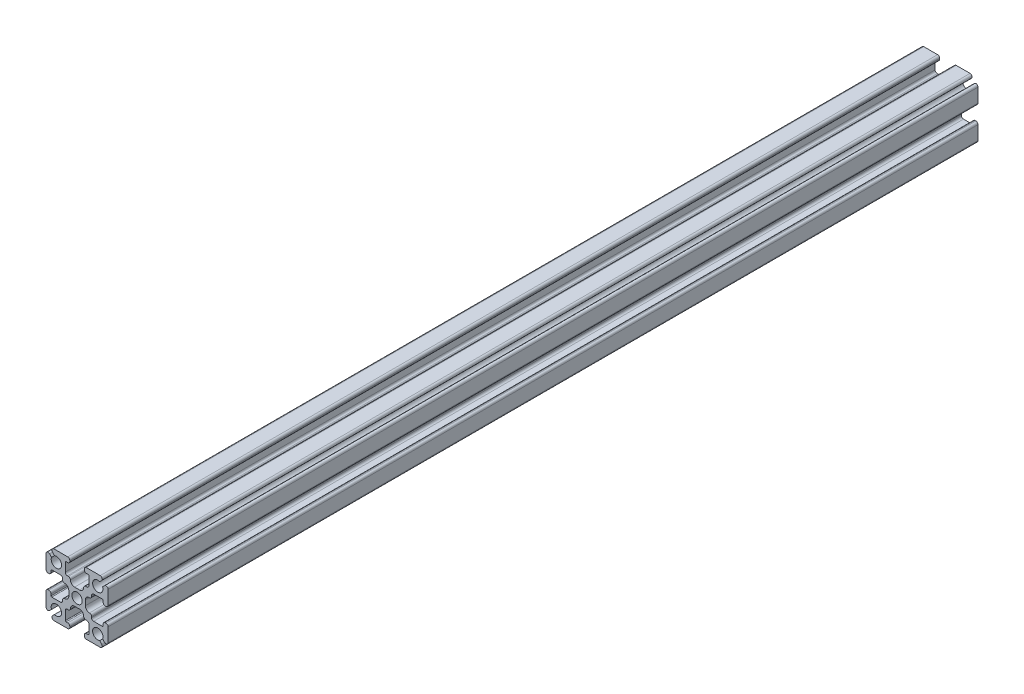
from build123d import *

# Parameters (mm, degrees)
SKETCH1_R           = 1.25
BOSS_EXTRUDE1_DEPTH = 210


with BuildPart() as part:
    # Sketch1 → Boss-Extrude1 (new body)
    with BuildSketch(Plane.XY):
        with BuildLine():
            Line((6.646446609, 5.939339828), (6.163645978, 5.456539197))
            ThreePointArc((6.163645978, 5.456539197), (4.116116524, 4.116116524), (5.456539197, 6.163645978))
            Line((5.456539197, 6.163645978), (5.939339828, 6.646446609))
            ThreePointArc((5.939339828, 6.646446609), (6.047726204, 7.191341716), (5.585786438, 7.5))
            Line((5.585786438, 7.5), (2.25, 7.5))
            ThreePointArc((2.25, 7.5), (1.896446609, 7.353553391), (1.75, 7))
            Line((1.75, 7), (1.75, 6.8))
            ThreePointArc((1.75, 6.8), (1.896446609, 6.446446609), (2.25, 6.3))
            Line((2.25, 6.3), (2.65, 6.3))
            ThreePointArc((2.65, 6.3), (2.791421356, 6.241421356), (2.85, 6.1))
            Line((2.85, 6.1), (2.85, 4))
            ThreePointArc((2.85, 4), (2.703553391, 3.646446609), (2.35, 3.5))
            Line((2.35, 3.5), (2.1, 3.5))
            ThreePointArc((2.1, 3.5), (1.746446609, 3.353553391), (1.6, 3))
            ThreePointArc((1.6, 3), (1.307106781, 2.292893219), (0.6, 2))
            Line((0.6, 2), (-0.6, 2))
            ThreePointArc((-0.6, 2), (-1.307106781, 2.292893219), (-1.6, 3))
            ThreePointArc((-1.6, 3), (-1.746446609, 3.353553391), (-2.1, 3.5))
            Line((-2.1, 3.5), (-2.35, 3.5))
            ThreePointArc((-2.35, 3.5), (-2.703553391, 3.646446609), (-2.85, 4))
            Line((-2.85, 4), (-2.85, 6.1))
            ThreePointArc((-2.85, 6.1), (-2.791421356, 6.241421356), (-2.65, 6.3))
            Line((-2.65, 6.3), (-2.25, 6.3))
            ThreePointArc((-2.25, 6.3), (-1.896446609, 6.446446609), (-1.75, 6.8))
            Line((-1.75, 6.8), (-1.75, 7))
            ThreePointArc((-1.75, 7), (-1.896446609, 7.353553391), (-2.25, 7.5))
            Line((-2.25, 7.5), (-5.585786438, 7.5))
            ThreePointArc((-5.585786438, 7.5), (-6.047726204, 7.191341716), (-5.939339828, 6.646446609))
            Line((-5.939339828, 6.646446609), (-5.456539197, 6.163645978))
            ThreePointArc((-5.456539197, 6.163645978), (-4.116116524, 4.116116524), (-6.163645978, 5.456539197))
            Line((-6.163645978, 5.456539197), (-6.646446609, 5.939339828))
            ThreePointArc((-6.646446609, 5.939339828), (-7.191341716, 6.047726204), (-7.5, 5.585786438))
            Line((-7.5, 5.585786438), (-7.5, 2.25))
            ThreePointArc((-7.5, 2.25), (-7.353553391, 1.896446609), (-7, 1.75))
            Line((-7, 1.75), (-6.8, 1.75))
            ThreePointArc((-6.8, 1.75), (-6.446446609, 1.896446609), (-6.3, 2.25))
            Line((-6.3, 2.25), (-6.3, 2.65))
            ThreePointArc((-6.3, 2.65), (-6.241421356, 2.791421356), (-6.1, 2.85))
            Line((-6.1, 2.85), (-4, 2.85))
            ThreePointArc((-4, 2.85), (-3.646446609, 2.703553391), (-3.5, 2.35))
            Line((-3.5, 2.35), (-3.5, 2.1))
            ThreePointArc((-3.5, 2.1), (-3.353553391, 1.746446609), (-3, 1.6))
            ThreePointArc((-3, 1.6), (-2.292893219, 1.307106781), (-2, 0.6))
            Line((-2, 0.6), (-2, -0.6))
            ThreePointArc((-2, -0.6), (-2.292893219, -1.307106781), (-3, -1.6))
            ThreePointArc((-3, -1.6), (-3.353553391, -1.746446609), (-3.5, -2.1))
            Line((-3.5, -2.1), (-3.5, -2.35))
            ThreePointArc((-3.5, -2.35), (-3.646446609, -2.703553391), (-4, -2.85))
            Line((-4, -2.85), (-6.1, -2.85))
            ThreePointArc((-6.1, -2.85), (-6.241421356, -2.791421356), (-6.3, -2.65))
            Line((-6.3, -2.65), (-6.3, -2.25))
            ThreePointArc((-6.3, -2.25), (-6.446446609, -1.896446609), (-6.8, -1.75))
            Line((-6.8, -1.75), (-7, -1.75))
            ThreePointArc((-7, -1.75), (-7.353553391, -1.896446609), (-7.5, -2.25))
            Line((-7.5, -2.25), (-7.5, -5.585786438))
            ThreePointArc((-7.5, -5.585786438), (-7.191341716, -6.047726204), (-6.646446609, -5.939339828))
            Line((-6.646446609, -5.939339828), (-6.163645978, -5.456539197))
            ThreePointArc((-6.163645978, -5.456539197), (-4.116116524, -4.116116524), (-5.456539197, -6.163645978))
            Line((-5.456539197, -6.163645978), (-5.939339828, -6.646446609))
            ThreePointArc((-5.939339828, -6.646446609), (-6.047726204, -7.191341716), (-5.585786438, -7.5))
            Line((-5.585786438, -7.5), (-2.25, -7.5))
            ThreePointArc((-2.25, -7.5), (-1.896446609, -7.353553391), (-1.75, -7))
            Line((-1.75, -7), (-1.75, -6.8))
            ThreePointArc((-1.75, -6.8), (-1.896446609, -6.446446609), (-2.25, -6.3))
            Line((-2.25, -6.3), (-2.65, -6.3))
            ThreePointArc((-2.65, -6.3), (-2.791421356, -6.241421356), (-2.85, -6.1))
            Line((-2.85, -6.1), (-2.85, -4))
            ThreePointArc((-2.85, -4), (-2.703553391, -3.646446609), (-2.35, -3.5))
            Line((-2.35, -3.5), (-2.1, -3.5))
            ThreePointArc((-2.1, -3.5), (-1.746446609, -3.353553391), (-1.6, -3))
            ThreePointArc((-1.6, -3), (-1.307106781, -2.292893219), (-0.6, -2))
            Line((-0.6, -2), (0.6, -2))
            ThreePointArc((0.6, -2), (1.307106781, -2.292893219), (1.6, -3))
            ThreePointArc((1.6, -3), (1.746446609, -3.353553391), (2.1, -3.5))
            Line((2.1, -3.5), (2.35, -3.5))
            ThreePointArc((2.35, -3.5), (2.703553391, -3.646446609), (2.85, -4))
            Line((2.85, -4), (2.85, -6.1))
            ThreePointArc((2.85, -6.1), (2.791421356, -6.241421356), (2.65, -6.3))
            Line((2.65, -6.3), (2.25, -6.3))
            ThreePointArc((2.25, -6.3), (1.896446609, -6.446446609), (1.75, -6.8))
            Line((1.75, -6.8), (1.75, -7))
            ThreePointArc((1.75, -7), (1.896446609, -7.353553391), (2.25, -7.5))
            Line((2.25, -7.5), (5.585786438, -7.5))
            ThreePointArc((5.585786438, -7.5), (6.047726204, -7.191341716), (5.939339828, -6.646446609))
            Line((5.939339828, -6.646446609), (5.456539197, -6.163645978))
            ThreePointArc((5.456539197, -6.163645978), (4.116116524, -4.116116524), (6.163645978, -5.456539197))
            Line((6.163645978, -5.456539197), (6.646446609, -5.939339828))
            ThreePointArc((6.646446609, -5.939339828), (7.191341716, -6.047726204), (7.5, -5.585786438))
            Line((7.5, -5.585786438), (7.5, -2.25))
            ThreePointArc((7.5, -2.25), (7.353553391, -1.896446609), (7, -1.75))
            Line((7, -1.75), (6.8, -1.75))
            ThreePointArc((6.8, -1.75), (6.446446609, -1.896446609), (6.3, -2.25))
            Line((6.3, -2.25), (6.3, -2.65))
            ThreePointArc((6.3, -2.65), (6.241421356, -2.791421356), (6.1, -2.85))
            Line((6.1, -2.85), (4, -2.85))
            ThreePointArc((4, -2.85), (3.646446609, -2.703553391), (3.5, -2.35))
            Line((3.5, -2.35), (3.5, -2.1))
            ThreePointArc((3.5, -2.1), (3.353553391, -1.746446609), (3, -1.6))
            ThreePointArc((3, -1.6), (2.292893219, -1.307106781), (2, -0.6))
            Line((2, -0.6), (2, 0.6))
            ThreePointArc((2, 0.6), (2.292893219, 1.307106781), (3, 1.6))
            ThreePointArc((3, 1.6), (3.353553391, 1.746446609), (3.5, 2.1))
            Line((3.5, 2.1), (3.5, 2.35))
            ThreePointArc((3.5, 2.35), (3.646446609, 2.703553391), (4, 2.85))
            Line((4, 2.85), (6.1, 2.85))
            ThreePointArc((6.1, 2.85), (6.241421356, 2.791421356), (6.3, 2.65))
            Line((6.3, 2.65), (6.3, 2.25))
            ThreePointArc((6.3, 2.25), (6.446446609, 1.896446609), (6.8, 1.75))
            Line((6.8, 1.75), (7, 1.75))
            ThreePointArc((7, 1.75), (7.353553391, 1.896446609), (7.5, 2.25))
            Line((7.5, 2.25), (7.5, 5.585786438))
            ThreePointArc((7.5, 5.585786438), (7.191341716, 6.047726204), (6.646446609, 5.939339828))
        make_face()
        with Locations(Location((0, 0, 0), (0, 0, 180))):
            Circle(SKETCH1_R, mode=Mode.SUBTRACT)
    extrude(amount=BOSS_EXTRUDE1_DEPTH)


solid = part.part
